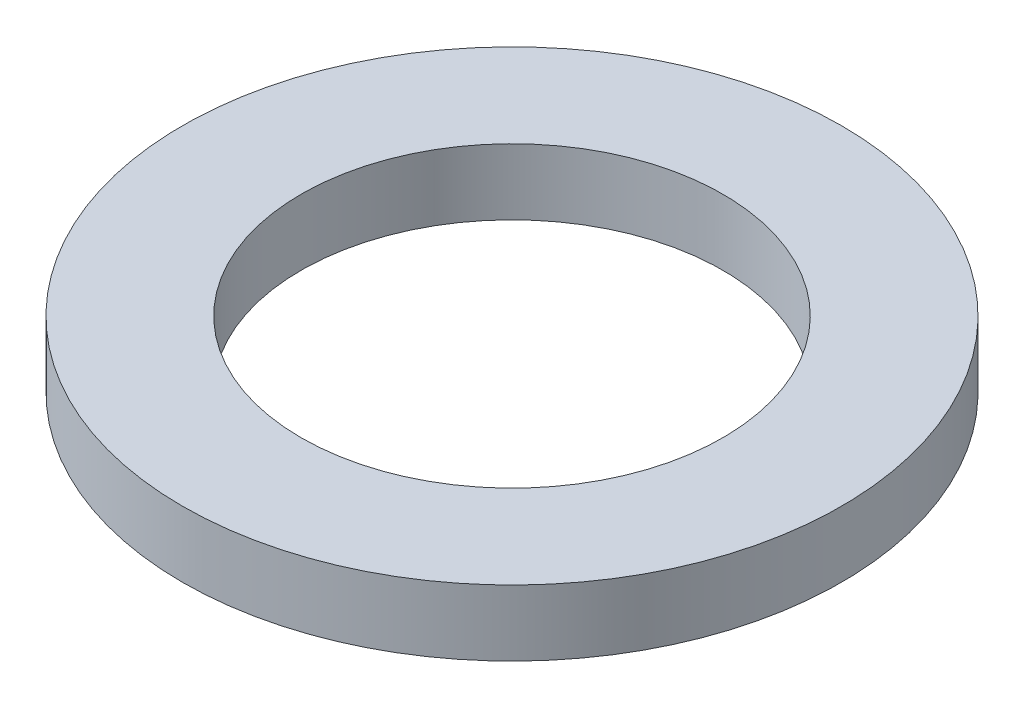
from build123d import *

# Parameters (mm, degrees)
SKETCH_1_R      = 2.5
SKETCH_1_R_2    = 1.6
EXTRUDE_1_DEPTH = 0.5


with BuildPart() as part:
    # 草图1 → 凸台-拉伸1 (new body)
    with BuildSketch(Plane(origin=(0, 0, 0), x_dir=(1, 0, 0), z_dir=(0, 1, 0))):
        with Locations(Location((0, 0, 0), (0, 0, 270))):
            Circle(SKETCH_1_R)
        with Locations(Location((0, 0, 0), (0, 0, 270))):
            Circle(SKETCH_1_R_2, mode=Mode.SUBTRACT)
    extrude(amount=EXTRUDE_1_DEPTH)


solid = part.part
